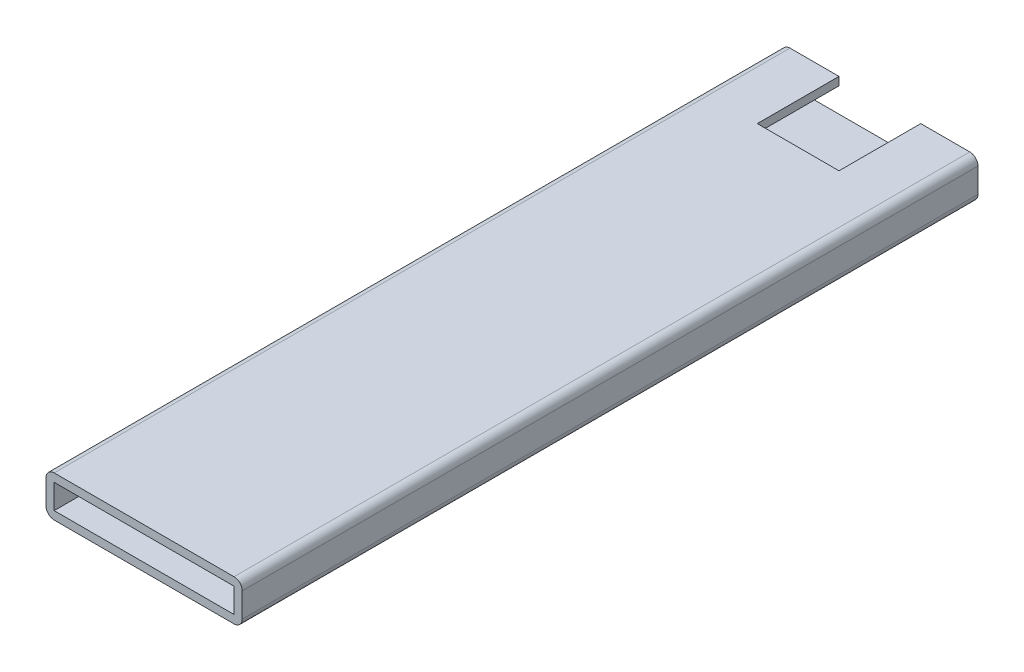
from build123d import *

# Parameters (mm, degrees)
SKETCH_1_W          = 22
SKETCH_1_H          = 3
EXTRUDE_1_DEPTH     = 90
SKETCH_2_W          = 10
SKETCH_2_H          = 10
CUT_EXTRUDE_1_DEPTH = 1


with BuildPart() as part:
    # 草图1 → 凸台-拉伸1 (new body)
    with BuildSketch(Plane.XY):
        with BuildLine():
            Line((0, 4), (22, 4))
            ThreePointArc((22, 4), (22.707106781, 3.707106781), (23, 3))
            Line((23, 3), (23, 0))
            ThreePointArc((23, 0), (22.707106781, -0.707106781), (22, -1))
            Line((22, -1), (0, -1))
            ThreePointArc((0, -1), (-0.707106781, -0.707106781), (-1, 0))
            Line((-1, 0), (-1, 3))
            ThreePointArc((-1, 3), (-0.707106781, 3.707106781), (0, 4))
        make_face()
        with Locations((11, 1.5)):
            Rectangle(SKETCH_1_W, SKETCH_1_H, mode=Mode.SUBTRACT)
    extrude(amount=EXTRUDE_1_DEPTH)

    # 草图2 → 切除-拉伸1 (cut)
    with BuildSketch(Plane(origin=(0, 4, 0), x_dir=(1, 0, 0), z_dir=(0, 1, 0))):
        with Locations((11, -5)):
            Rectangle(SKETCH_2_W, SKETCH_2_H)
    extrude(amount=-CUT_EXTRUDE_1_DEPTH, mode=Mode.SUBTRACT)


solid = part.part
